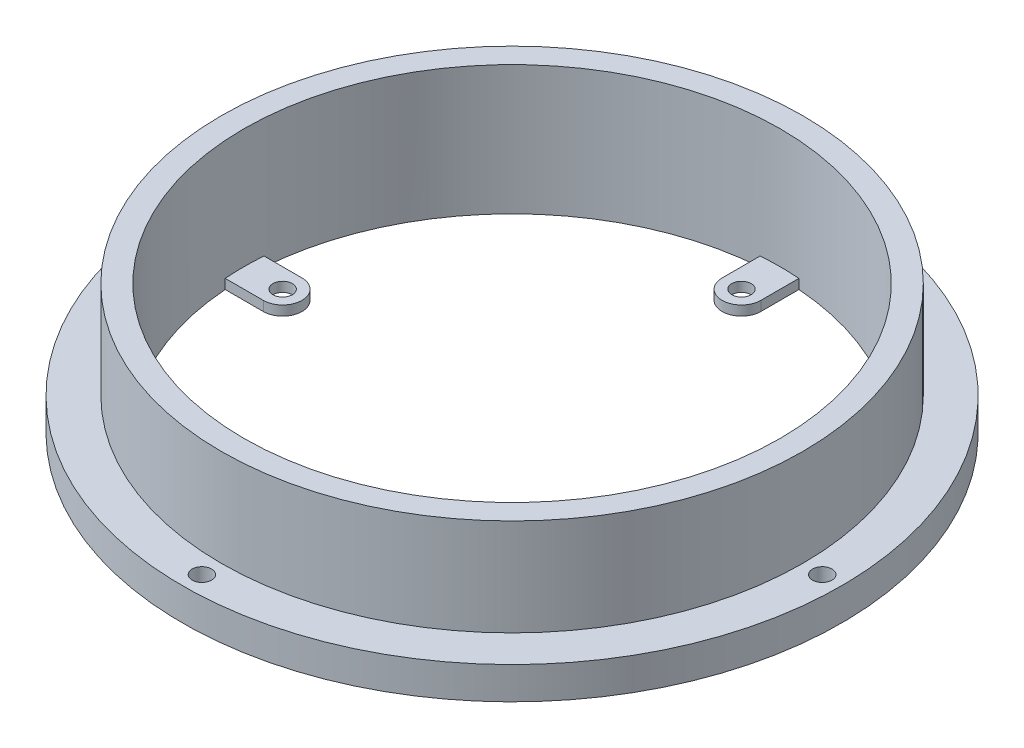
from build123d import *

# Parameters (mm, degrees)
SKETCH1_R           = 45
SKETCH1_R_2         = 42
BOSS_EXTRUDE1_DEPTH = 20
SKETCH2_R           = 51
SKETCH2_R_2         = 1.5
SKETCH2_R_3         = 45
BOSS_EXTRUDE2_DEPTH = 5
BOSS_EXTRUDE3_START = -20
SKETCH3_R           = 42
SKETCH3_R_2         = 41.5
BOSS_EXTRUDE3_DEPTH = 20
SKETCH5_R           = 1.5
BOSS_EXTRUDE4_DEPTH = 1.5


with BuildPart() as part:
    # Sketch1 → Boss-Extrude1 (new body)
    with BuildSketch(Plane(origin=(0, 0, 0), x_dir=(1, 0, 0), z_dir=(0, 1, 0))):
        with Locations(Location((0, 0, 0), (0, 0, 270))):
            Circle(SKETCH1_R)
        with Locations(Location((0, 0, 0), (0, 0, 270))):
            Circle(SKETCH1_R_2, mode=Mode.SUBTRACT)
    extrude(amount=BOSS_EXTRUDE1_DEPTH)

    # Sketch2 → Boss-Extrude2 (add)
    with BuildSketch(Plane.XZ):
        with Locations(Location((0, 0, 0), (0, 0, 270))):
            Circle(SKETCH2_R)
        with Locations(Location((0, -48, 0), (0, 0, 270))):
            Circle(SKETCH2_R_2, mode=Mode.SUBTRACT)
        with Locations(Location((-48, 0, 0), (0, 0, 270))):
            Circle(SKETCH2_R_2, mode=Mode.SUBTRACT)
        with Locations(Location((0, 0, 0), (0, 0, 270))):
            Circle(SKETCH2_R_3, mode=Mode.SUBTRACT)
        with BuildLine():
            ThreePointArc((49.5, 0), (48, -1.5), (46.5, 0))
            ThreePointArc((46.5, 0), (48, 1.5), (49.5, 0))
        make_face(mode=Mode.SUBTRACT)
        with Locations(Location((0, 48, 0), (0, 0, 270))):
            Circle(SKETCH2_R_2, mode=Mode.SUBTRACT)
    extrude(amount=-BOSS_EXTRUDE2_DEPTH)

    # Sketch3 → Boss-Extrude3 (add)
    with BuildSketch(Plane(origin=(0, 20, 0), x_dir=(1, 0, 0), z_dir=(0, 1, 0)).offset(BOSS_EXTRUDE3_START)):
        Circle(SKETCH3_R)
        with Locations(Location((0, 0, 0), (0, 0, 270))):
            Circle(SKETCH3_R_2, mode=Mode.SUBTRACT)
    extrude(amount=BOSS_EXTRUDE3_DEPTH)

    # Sketch5 → Boss-Extrude4 (add)
    # profile 1 of 4: a face of its own
    with BuildSketch(Plane.XZ):
        with BuildLine():
            Line((35.5, 3), (42.194384288, 3))
            Line((42.194384288, 3), (42.194384288, -3))
            Line((42.194384288, -3), (35.5, -3))
            ThreePointArc((35.5, -3), (32.5, 0), (35.5, 3))
        make_face()
        with Locations(Location((35.5, 0, 0), (0, 0, 270))):
            Circle(SKETCH5_R, mode=Mode.SUBTRACT)
    # profile 2 of 4: a face of its own
    with BuildSketch(Plane.XZ):
        with BuildLine():
            Line((-3, 35.5), (-3, 42.194384288))
            Line((-3, 42.194384288), (3, 42.194384288))
            Line((3, 42.194384288), (3, 35.5))
            ThreePointArc((3, 35.5), (0, 32.5), (-3, 35.5))
        make_face()
        with Locations(Location((0, 35.5, 0), (0, 0, 270))):
            Circle(SKETCH5_R, mode=Mode.SUBTRACT)
    # profile 3 of 4: a face of its own
    with BuildSketch(Plane.XZ):
        with BuildLine():
            Line((3, -35.5), (3, -42.194384288))
            Line((3, -42.194384288), (-3, -42.194384288))
            Line((-3, -42.194384288), (-3, -35.5))
            ThreePointArc((-3, -35.5), (0, -32.5), (3, -35.5))
        make_face()
        with Locations(Location((0, -35.5, 0), (0, 0, 270))):
            Circle(SKETCH5_R, mode=Mode.SUBTRACT)
    # profile 4 of 4: a face of its own
    with BuildSketch(Plane.XZ):
        with BuildLine():
            Line((-35.5, -3), (-42.194384288, -3))
            Line((-42.194384288, -3), (-42.194384288, 3))
            Line((-42.194384288, 3), (-35.5, 3))
            ThreePointArc((-35.5, 3), (-32.5, 0), (-35.5, -3))
        make_face()
        with Locations(Location((-35.5, 0, 0), (0, 0, 270))):
            Circle(SKETCH5_R, mode=Mode.SUBTRACT)
    extrude(amount=-BOSS_EXTRUDE4_DEPTH)


solid = part.part
